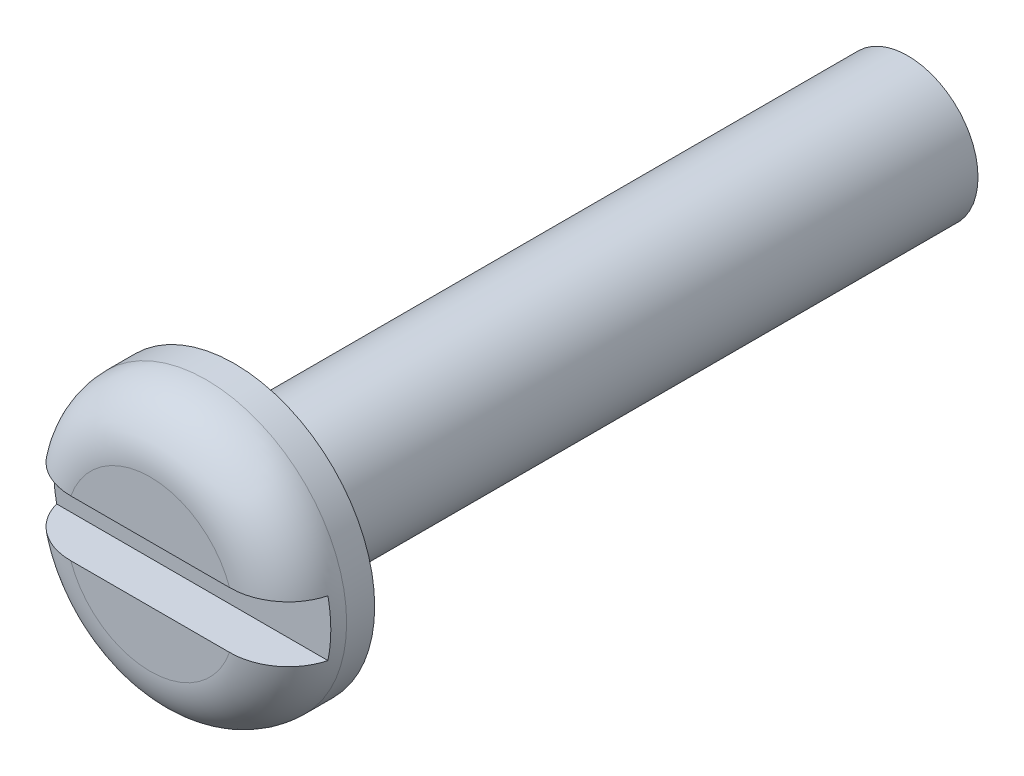
from build123d import *

# Parameters (mm, degrees)
SKETCH2_R           = 1.25
BOSS_EXTRUDE1_DEPTH = 12
SKETCH3_R           = 2.5
BOSS_EXTRUDE2_DEPTH = 1.5
FILLET1_R           = 1
SKETCH4_W           = 6.108207577
SKETCH4_H           = 1
CUT_EXTRUDE1_DEPTH  = 0.75


with BuildPart() as part:
    # Sketch2 → Boss-Extrude1 (new body)
    with BuildSketch(Plane.XY):
        Circle(SKETCH2_R)
    extrude(amount=-BOSS_EXTRUDE1_DEPTH)

    # Sketch3 → Boss-Extrude2 (add)
    with BuildSketch(Plane.XY):
        Circle(SKETCH3_R)
    extrude(amount=BOSS_EXTRUDE2_DEPTH)

    # Fillet1
    fillet1_edges = [part.edges().sort_by_distance(p)[0] for p in [
        (-2.5, 0, 1.5),
    ]]
    fillet(fillet1_edges, radius=FILLET1_R)

    # Sketch4 → Cut-Extrude1 (cut)
    with BuildSketch(Plane.XY.offset(1.5)):
        with Locations((-0.048809877, 0)):
            Rectangle(SKETCH4_W, SKETCH4_H)
    extrude(amount=-CUT_EXTRUDE1_DEPTH, mode=Mode.SUBTRACT)


solid = part.part
